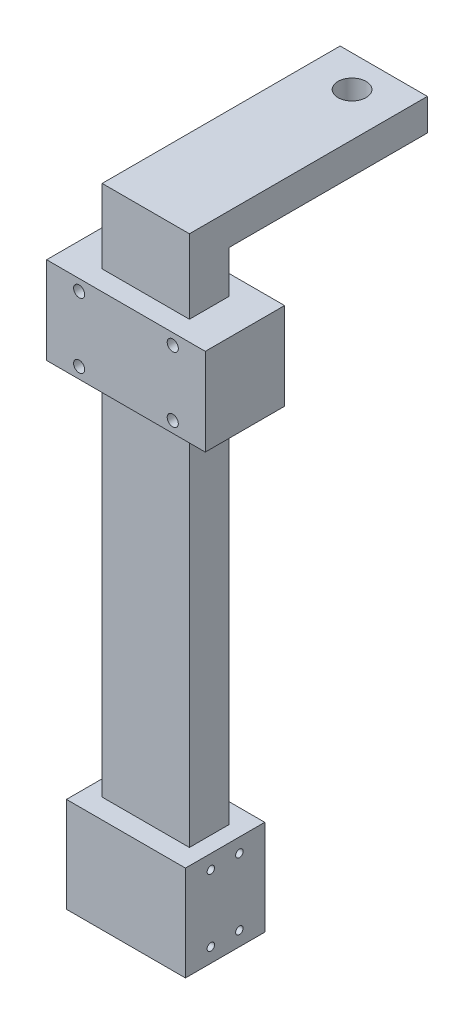
from build123d import *

# Parameters (mm, degrees)
SKETCH1_W                = 13.97
SKETCH1_H                = 6.35
BOSS_EXTRUDE1_DEPTH      = 95.25
SKETCH3_W                = 25.4
SKETCH3_H                = 13.97
BOSS_EXTRUDE3_DEPTH      = 6.35
BOSS_EXTRUDE5_DEPTH      = 9.525
BOSS_EXTRUDE5_DEPTH_BACK = 9.525
SKETCH5_W                = 12.7
SKETCH5_H                = 15.24
SKETCH6_W                = 13.97
SKETCH6_H                = 38.1
BOSS_EXTRUDE6_DEPTH      = 5.08
SKETCH7_R                = 2.25
CUT_EXTRUDE1_DEPTH       = 5.08
SKETCH8_R                = 0.59563
CUT_EXTRUDE2_DEPTH       = 109.534856843
SKETCH9_R                = 0.889
CUT_EXTRUDE3_DEPTH       = 109.069463309
BOSS_EXTRUDE7_DEPTH      = 6.35
BOSS_EXTRUDE7_DEPTH_BACK = 6.35
SKETCH10_W               = 25.4
SKETCH10_H               = 13.97
SKETCH10_R               = 0.889


with BuildPart() as part:
    # Sketch1 → Boss-Extrude1 (new body)
    with BuildSketch(Plane(origin=(0, 0, 0), x_dir=(1, 0, 0), z_dir=(0, 1, 0))):
        Rectangle(SKETCH1_W, SKETCH1_H)
    extrude(amount=BOSS_EXTRUDE1_DEPTH)

    # Sketch3 → Boss-Extrude3 (add)
    with BuildSketch(Plane.XY.offset(3.175)):
        with Locations((0, 81.491176781)):
            Rectangle(SKETCH3_W, SKETCH3_H)
    extrude(amount=-BOSS_EXTRUDE3_DEPTH)

    # Sketch5 → Boss-Extrude5 (add, two sides: drawn at the far end of the back side and taken through both)
    with BuildSketch(Plane(origin=(0, 0, 0), x_dir=(0, 0, -1), z_dir=(1, 0, 0)).offset(-BOSS_EXTRUDE5_DEPTH_BACK)):
        with Locations((0, 7.62)):
            Rectangle(SKETCH5_W, SKETCH5_H)
    extrude(amount=BOSS_EXTRUDE5_DEPTH + BOSS_EXTRUDE5_DEPTH_BACK)

    # Sketch6 → Boss-Extrude6 (add)
    with BuildSketch(Plane(origin=(0, 95.25, 0), x_dir=(1, 0, 0), z_dir=(0, 1, 0))):
        with Locations((0, 15.875)):
            Rectangle(SKETCH6_W, SKETCH6_H)
    extrude(amount=BOSS_EXTRUDE6_DEPTH)

    # Sketch7 → Cut-Extrude1 (cut)
    with BuildSketch(Plane(origin=(0, 100.33, 0), x_dir=(1, 0, 0), z_dir=(0, 1, 0))):
        with Locations(Location((0, 29.845, 0), (0, 0, 270))):
            Circle(SKETCH7_R)
    extrude(amount=-CUT_EXTRUDE1_DEPTH, mode=Mode.SUBTRACT)

    # Sketch8 → Cut-Extrude2 (cut, through all)
    with BuildSketch(Plane.ZY.offset(9.525)):
        with Locations((-2.286, 12.954)):
            Circle(SKETCH8_R)
        with Locations((2.286, 12.954)):
            Circle(SKETCH8_R)
        with Locations((2.286, 2.286)):
            Circle(SKETCH8_R)
        with Locations((-2.286, 2.286)):
            Circle(SKETCH8_R)
    extrude(amount=-CUT_EXTRUDE2_DEPTH, mode=Mode.SUBTRACT)

    # Sketch9 → Cut-Extrude3 (cut, through all)
    with BuildSketch(Plane.XY.offset(3.175)):
        with Locations((-7.493, 86.698176781)):
            Circle(SKETCH9_R)
        with Locations((7.493, 86.698176781)):
            Circle(SKETCH9_R)
        with Locations((7.493, 76.284176781)):
            Circle(SKETCH9_R)
        with Locations((-7.493, 76.284176781)):
            Circle(SKETCH9_R)
    extrude(amount=-CUT_EXTRUDE3_DEPTH, mode=Mode.SUBTRACT)

    # Sketch10 → Boss-Extrude7 (add, two sides: drawn at the far end of the back side and taken through both)
    with BuildSketch(Plane.XY.offset(-BOSS_EXTRUDE7_DEPTH_BACK)):
        with Locations((0, 81.491176781)):
            Rectangle(SKETCH10_W, SKETCH10_H)
        with Locations((-7.493, 86.698176781)):
            Circle(SKETCH10_R, mode=Mode.SUBTRACT)
        with Locations((-7.493, 76.284176781)):
            Circle(SKETCH10_R, mode=Mode.SUBTRACT)
        with Locations((7.493, 76.284176781)):
            Circle(SKETCH10_R, mode=Mode.SUBTRACT)
        with Locations((7.493, 86.698176781)):
            Circle(SKETCH10_R, mode=Mode.SUBTRACT)
    extrude(amount=BOSS_EXTRUDE7_DEPTH + BOSS_EXTRUDE7_DEPTH_BACK)


solid = part.part
